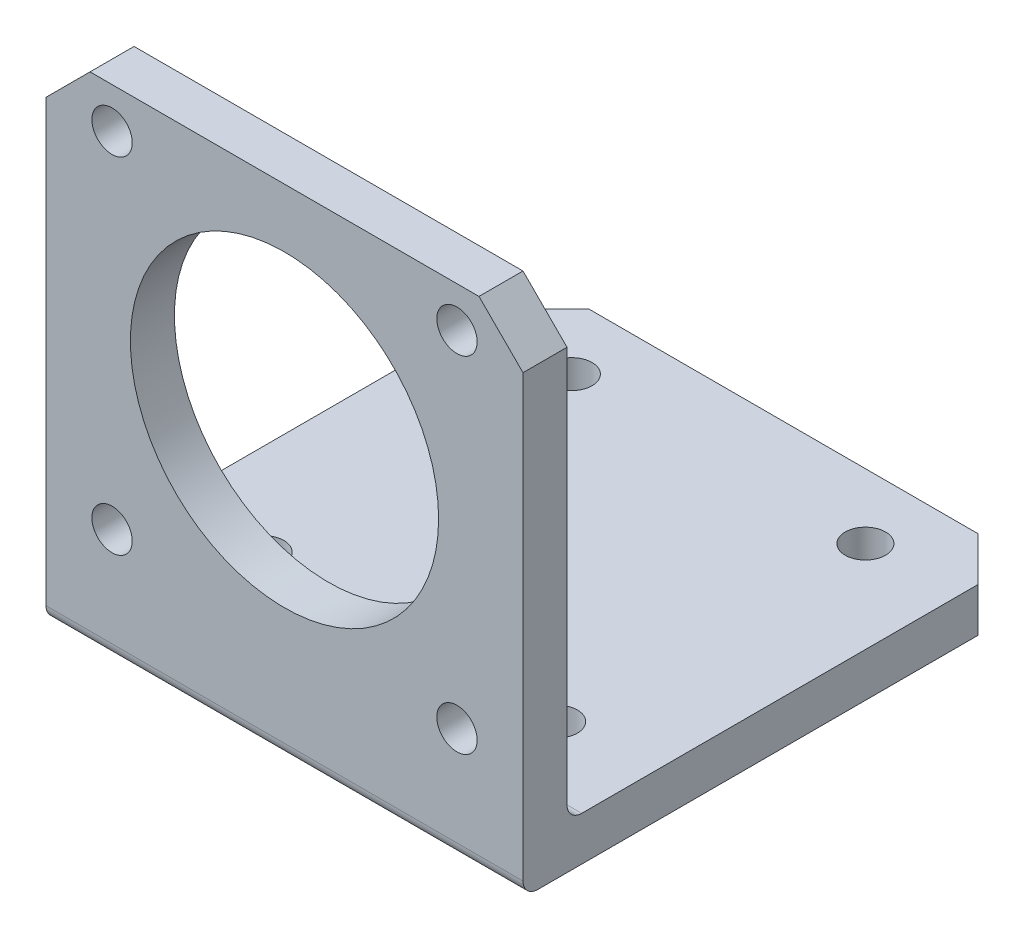
from build123d import *

# Parameters (mm, degrees)
SKETCH_1_W          = 65
SKETCH_1_H          = 68
SKETCH_1_R          = 21
EXTRUDE_1_DEPTH     = 6
SKETCH_3_W          = 62
SKETCH_3_H          = 6
EXTRUDE_2_DEPTH     = 65
CHAMFER_2_SIZE      = 6
CHAMFER_3_SIZE      = 6
CHAMFER_4_SIZE      = 6
CHAMFER_5_SIZE      = 6
FILLET_1_R          = 2
FILLET_2_R          = 2
SKETCH_5_R          = 2.75
CUT_EXTRUDE_3_DEPTH = 88.759227349
SKETCH_6_R          = 2.75
CUT_EXTRUDE_4_DEPTH = 95.80177845


with BuildPart() as part:
    # 草图1 → 凸台-拉伸1 (new body)
    with BuildSketch(Plane.XY):
        with Locations((3.546875, 16.5796875)):
            Rectangle(SKETCH_1_W, SKETCH_1_H)
        with Locations((3.546875, 21.5796875)):
            Circle(SKETCH_1_R, mode=Mode.SUBTRACT)
    extrude(amount=EXTRUDE_1_DEPTH)

    # 草图3 → 凸台-拉伸2 (add)
    with BuildSketch(Plane(origin=(36.046875, 0, 0), x_dir=(0, 0, -1), z_dir=(1, 0, 0))):
        with Locations((31, -14.4203125)):
            Rectangle(SKETCH_3_W, SKETCH_3_H)
    extrude(amount=-EXTRUDE_2_DEPTH)

    # 倒角2
    chamfer_2_edges = [part.edges().sort_by_distance(p)[0] for p in [
        (36.046875, -14.4203125, -62),
    ]]
    chamfer(chamfer_2_edges, length=CHAMFER_2_SIZE)

    # 倒角3
    chamfer_3_edges = [part.edges().sort_by_distance(p)[0] for p in [
        (-28.953125, -14.4203125, -62),
    ]]
    chamfer(chamfer_3_edges, length=CHAMFER_3_SIZE)

    # 倒角4
    chamfer_4_edges = [part.edges().sort_by_distance(p)[0] for p in [
        (-28.953125, 50.5796875, 3),
    ]]
    chamfer(chamfer_4_edges, length=CHAMFER_4_SIZE)

    # 倒角5
    chamfer_5_edges = [part.edges().sort_by_distance(p)[0] for p in [
        (36.046875, 50.5796875, 3),
    ]]
    chamfer(chamfer_5_edges, length=CHAMFER_5_SIZE)

    # 圆角1
    fillet_1_edges = [part.edges().sort_by_distance(p)[0] for p in [
        (3.546875, -17.4203125, 6),
    ]]
    fillet(fillet_1_edges, radius=FILLET_1_R)

    # 圆角2
    fillet_2_edges = [part.edges().sort_by_distance(p)[0] for p in [
        (3.546875, -11.4203125, 0),
    ]]
    fillet(fillet_2_edges, radius=FILLET_2_R)

    # 草图5 → 切除-拉伸3 (cut, through all)
    with BuildSketch(Plane(origin=(0, 0, 0), x_dir=(-1, 0, 0), z_dir=(0, 0, -1))):
        with Locations((-27.046875, 45.0796875)):
            Circle(SKETCH_5_R)
        with Locations((19.953125, 45.0796875)):
            Circle(SKETCH_5_R)
        with Locations((19.953125, -1.9203125)):
            Circle(SKETCH_5_R)
        with Locations((-27.046875, -1.9203125)):
            Circle(SKETCH_5_R)
    extrude(amount=-CUT_EXTRUDE_3_DEPTH, mode=Mode.SUBTRACT)

    # 草图6 → 切除-拉伸4 (cut, through all)
    with BuildSketch(Plane(origin=(0, -11.4203125, 0), x_dir=(1, 0, 0), z_dir=(0, 1, 0))):
        with Locations((23.546875, 11.156752463)):
            Circle(SKETCH_6_R)
        with Locations((23.546875, 53.156752463)):
            Circle(SKETCH_6_R)
        with Locations((-16.453125, 53.156752463)):
            Circle(SKETCH_6_R)
        with Locations((-16.453125, 11.156752463)):
            Circle(SKETCH_6_R)
    extrude(amount=-CUT_EXTRUDE_4_DEPTH, mode=Mode.SUBTRACT)


solid = part.part
